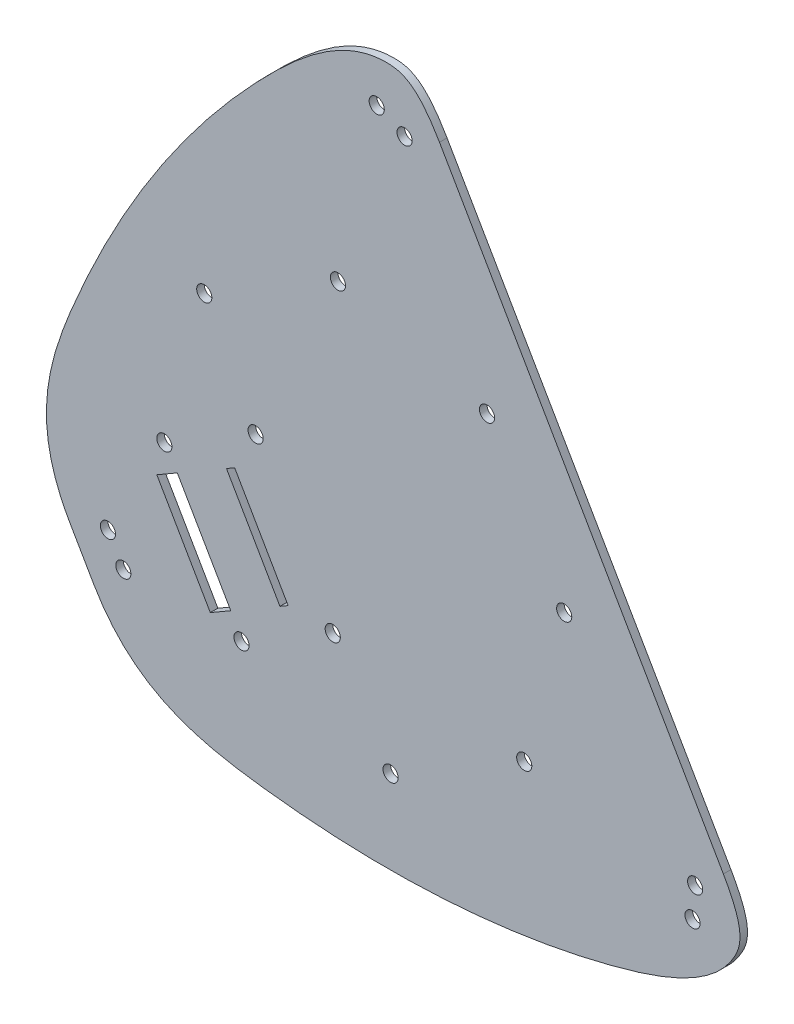
from build123d import *

# Parameters (mm, degrees)
SKETCH1_R         = 1.6
PLATE_DEPTH       = 1.6
MAST_REACH        = 125.511
SKETCH5_R         = 1.6
FLEX_SLOT_REACH   = 125.511
FLEX_SCREWS_REACH = 125.511
SKETCH8_R         = 1.6


with BuildPart() as part:
    # Sketch1 → Plate (new body)
    with BuildSketch(Plane.XY):
        with BuildLine():
            Line((-91.74011313, -47.101462966), (-86.661120049, -55.898537034))
            add(Edge.make_bspline(
                [(46.454482672, -42.461524227), (51.012463207, -50.356178094), (48.363057384, -62.963074023), (9.351058761, -77.00992556), (-41.227325625, -78.712130765), (-78.13483155, -70.666501915), (-86.661120049, -55.898537034)],
                knots=[0, 0, 0, 0, 0.073999004, 0.28665872, 0.740794667, 1, 1, 1, 1], degree=3))
            Line((46.454482672, -42.461524227), (-13.545517328, 61.461524227))
            add(Edge.make_bspline(
                [(-13.545517328, 61.461524227), (-18.103497863, 69.356178094), (-30.346092912, 73.365173311), (-62.017022498, 46.603217219), (-88.780367641, 3.652154061), (-100.26640163, -32.333498085), (-91.74011313, -47.101462966)],
                knots=[0, 0, 0, 0, 0.073999004, 0.28665872, 0.740794667, 1, 1, 1, 1], degree=3))
        make_face()
        with Locations((-26.811674635, 61.590895552)):
            Circle(SKETCH1_R, mode=Mode.SUBTRACT)
        with Locations((-20.925837478, 58.832830838)):
            Circle(SKETCH1_R, mode=Mode.SUBTRACT)
        with Locations((-83.617134672, -44.523598462)):
            Circle(SKETCH1_R, mode=Mode.SUBTRACT)
        with Locations((-80.367134672, -50.152763587)):
            Circle(SKETCH1_R, mode=Mode.SUBTRACT)
        with Locations((40.487807343, -47.53872227)):
            Circle(SKETCH1_R, mode=Mode.SUBTRACT)
        with Locations((39.933442873, -54.015039128)):
            Circle(SKETCH1_R, mode=Mode.SUBTRACT)
    extrude(amount=PLATE_DEPTH)

    # Sketch5 → Mast (cut, up to next)
    with BuildSketch(Plane.XY, mode=Mode.PRIVATE) as mast_sk1:
        with Locations(Location((-35.007890041, 25.255379992, 0), (0, 0, 180))):
            Circle(SKETCH5_R)
    mast_tool1 = extrude(mast_sk1.sketch, amount=MAST_REACH, mode=Mode.PRIVATE) & part.part
    # Sketch5 → Mast (cut, up to next)
    with BuildSketch(Plane.XY, mode=Mode.PRIVATE) as mast_sk2:
        with Locations(Location((-55.390275833, -50.812719363, 0), (0, 0, 180))):
            Circle(SKETCH5_R)
    mast_tool2 = extrude(mast_sk2.sketch, amount=MAST_REACH, mode=Mode.PRIVATE) & part.part
    # Sketch5 → Mast (cut, up to next)
    with BuildSketch(Plane.XY, mode=Mode.PRIVATE) as mast_sk3:
        with Locations(Location((-3.499451624, 16.812719363, 0), (0, 0, 180))):
            Circle(SKETCH5_R)
    mast_tool3 = extrude(mast_sk3.sketch, amount=MAST_REACH, mode=Mode.PRIVATE) & part.part
    # Sketch5 → Mast (cut, up to next)
    with BuildSketch(Plane.XY, mode=Mode.PRIVATE) as mast_sk4:
        with Locations(Location((12.810516263, -11.436973688, 0), (0, 0, 180))):
            Circle(SKETCH5_R)
    mast_tool4 = extrude(mast_sk4.sketch, amount=MAST_REACH, mode=Mode.PRIVATE) & part.part
    # Sketch5 → Mast (cut, up to next)
    with BuildSketch(Plane.XY, mode=Mode.PRIVATE) as mast_sk5:
        with Locations(Location((4.367855635, -42.945412104, 0), (0, 0, 180))):
            Circle(SKETCH5_R)
    mast_tool5 = extrude(mast_sk5.sketch, amount=MAST_REACH, mode=Mode.PRIVATE) & part.part
    # Sketch5 → Mast (cut, up to next)
    with BuildSketch(Plane.XY, mode=Mode.PRIVATE) as mast_sk6:
        with Locations(Location((-23.881837416, -59.255379992, 0), (0, 0, 180))):
            Circle(SKETCH5_R)
    mast_tool6 = extrude(mast_sk6.sketch, amount=MAST_REACH, mode=Mode.PRIVATE) & part.part
    # Sketch5 → Mast (cut, up to next)
    with BuildSketch(Plane.XY, mode=Mode.PRIVATE) as mast_sk7:
        with Locations(Location((-71.70024372, -22.563026312, 0), (0, 0, 180))):
            Circle(SKETCH5_R)
    mast_tool7 = extrude(mast_sk7.sketch, amount=MAST_REACH, mode=Mode.PRIVATE) & part.part
    # Sketch5 → Mast (cut, up to next)
    with BuildSketch(Plane.XY, mode=Mode.PRIVATE) as mast_sk8:
        with Locations(Location((-63.257583092, 8.945412104, 0), (0, 0, 180))):
            Circle(SKETCH5_R)
    mast_tool8 = extrude(mast_sk8.sketch, amount=MAST_REACH, mode=Mode.PRIVATE) & part.part
    add(mast_tool1.solids().sort_by_distance((-35.00789, 25.25538, 0))[0], mode=Mode.SUBTRACT)
    add(mast_tool2.solids().sort_by_distance((-55.390276, -50.812719, 0))[0], mode=Mode.SUBTRACT)
    add(mast_tool3.solids().sort_by_distance((-3.499452, 16.812719, 0))[0], mode=Mode.SUBTRACT)
    add(mast_tool4.solids().sort_by_distance((12.810516, -11.436974, 0))[0], mode=Mode.SUBTRACT)
    add(mast_tool5.solids().sort_by_distance((4.367856, -42.945412, 0))[0], mode=Mode.SUBTRACT)
    add(mast_tool6.solids().sort_by_distance((-23.881837, -59.25538, 0))[0], mode=Mode.SUBTRACT)
    add(mast_tool7.solids().sort_by_distance((-71.700244, -22.563026, 0))[0], mode=Mode.SUBTRACT)
    add(mast_tool8.solids().sort_by_distance((-63.257583, 8.945412, 0))[0], mode=Mode.SUBTRACT)

    # Sketch6 → Flex slot (cut, up to next)
    with BuildSketch(Plane.XY, mode=Mode.PRIVATE) as flex_slot_sk1:
        Polygon((-57.656457017, -46.336087063), (-68.956457017, -26.763912937), (-73.286584036, -29.263912937), (-61.986584036, -48.836087063), align=None)
    flex_slot_tool1 = extrude(flex_slot_sk1.sketch, amount=FLEX_SLOT_REACH, mode=Mode.PRIVATE) & part.part
    # Sketch6 → Flex slot (cut, up to next)
    with BuildSketch(Plane.XY, mode=Mode.PRIVATE) as flex_slot_sk2:
        Polygon((-56.832101364, -19.763912937), (-58.564152171, -20.763912937), (-47.264152171, -40.336087063), (-45.532101364, -39.336087063), align=None)
    flex_slot_tool2 = extrude(flex_slot_sk2.sketch, amount=FLEX_SLOT_REACH, mode=Mode.PRIVATE) & part.part
    add(flex_slot_tool1.solids().sort_by_distance((-65.471521, -37.8, 0))[0], mode=Mode.SUBTRACT)
    add(flex_slot_tool2.solids().sort_by_distance((-52.048127, -30.05, 0))[0], mode=Mode.SUBTRACT)

    # Sketch8 → Flex screws (cut, up to next)
    with BuildSketch(Plane.XY, mode=Mode.PRIVATE) as flex_screws_sk1:
        with Locations(Location((-36.103898133, -39.666214082, 0), (0, 0, 180))):
            Circle(SKETCH8_R)
    flex_screws_tool1 = extrude(flex_screws_sk1.sketch, amount=FLEX_SCREWS_REACH, mode=Mode.PRIVATE) & part.part
    # Sketch8 → Flex screws (cut, up to next)
    with BuildSketch(Plane.XY, mode=Mode.PRIVATE) as flex_screws_sk2:
        with Locations(Location((-52.403898133, -11.433785918, 0), (0, 0, 180))):
            Circle(SKETCH8_R)
    flex_screws_tool2 = extrude(flex_screws_sk2.sketch, amount=FLEX_SCREWS_REACH, mode=Mode.PRIVATE) & part.part
    add(flex_screws_tool1.solids().sort_by_distance((-36.103898, -39.666214, 0))[0], mode=Mode.SUBTRACT)
    add(flex_screws_tool2.solids().sort_by_distance((-52.403898, -11.433786, 0))[0], mode=Mode.SUBTRACT)


solid = part.part
